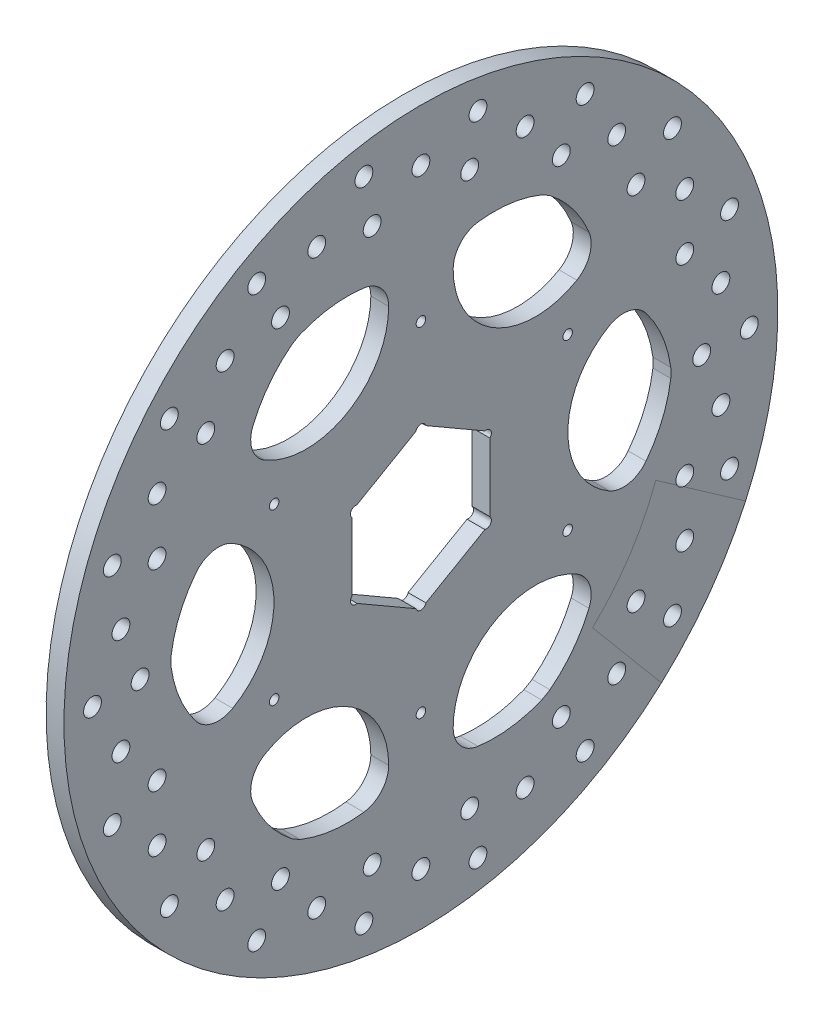
from build123d import *

# Parameters (mm, degrees)
SKETCH1_R           = 95.25
SKETCH1_R_2         = 66.675
MAIN_ROTOR_DEPTH    = 4.7625
SKETCH2_R           = 2.38125
CUT_SLOTS_DEPTH     = 135.788005424
BOSS_EXTRUDE2_START = -4.7625
BOSS_EXTRUDE2_DEPTH = 4.7625
SKETCH4_R           = 1.27
CUT_EXTRUDE2_DEPTH  = 135.788005424


with BuildPart() as part:
    # Sketch1 → Main Rotor (new body)
    with BuildSketch(Plane(origin=(0, 0, 0), x_dir=(0, 0, -1), z_dir=(1, 0, 0))):
        with Locations(Location((0, 0, 0), (0, 0, 180))):
            Circle(SKETCH1_R)
        with Locations(Location((0, 0, 0), (0, 0, 180))):
            Circle(SKETCH1_R_2, mode=Mode.SUBTRACT)
    extrude(amount=MAIN_ROTOR_DEPTH)

    # Sketch2 → Cut Slots (cut, through all)
    with BuildSketch(Plane(origin=(4.7625, 0, 0), x_dir=(0, 0, -1), z_dir=(1, 0, 0))):
        with Locations((-80.045174165, 14.114123881)):
            Circle(SKETCH2_R)
        with Locations((-82.345264359, 29.97122516)):
            Circle(SKETCH2_R)
        with Locations((-70.411168075, 25.627569339)):
            Circle(SKETCH2_R)
        with Locations((-70.39054482, 40.64)):
            Circle(SKETCH2_R)
        with Locations((-67.128474551, 56.327478237)):
            Circle(SKETCH2_R)
        with Locations((-57.399710123, 48.164075594)):
            Circle(SKETCH2_R)
        with Locations((-52.245776915, 62.264092337)):
            Circle(SKETCH2_R)
        with Locations((-87.63, 0)):
            Circle(SKETCH2_R)
        with Locations((-43.815, 75.889806134)):
            Circle(SKETCH2_R)
        with Locations((-37.465, 64.891283506)):
            Circle(SKETCH2_R)
        with Locations((-74.93, 0)):
            Circle(SKETCH2_R)
        with Locations((-27.79939725, 76.378216217)):
            Circle(SKETCH2_R)
        with Locations((-15.216789809, 86.298703396)):
            Circle(SKETCH2_R)
        with Locations((-13.011457953, 73.791644933)):
            Circle(SKETCH2_R)
        with Locations((0, 81.28)):
            Circle(SKETCH2_R)
        with Locations((15.216789809, 86.298703396)):
            Circle(SKETCH2_R)
        with Locations((13.011457953, 73.791644933)):
            Circle(SKETCH2_R)
        with Locations((27.79939725, 76.378216217)):
            Circle(SKETCH2_R)
        with Locations((43.815, 75.889806134)):
            Circle(SKETCH2_R)
        with Locations((37.465, 64.891283506)):
            Circle(SKETCH2_R)
        with Locations((52.245776915, 62.264092337)):
            Circle(SKETCH2_R)
        with Locations((67.128474551, 56.327478237)):
            Circle(SKETCH2_R)
        with Locations((57.399710123, 48.164075594)):
            Circle(SKETCH2_R)
        with Locations((70.39054482, 40.64)):
            Circle(SKETCH2_R)
        with Locations((82.345264359, 29.97122516)):
            Circle(SKETCH2_R)
        with Locations((70.411168075, 25.627569339)):
            Circle(SKETCH2_R)
        with Locations((80.045174165, 14.114123881)):
            Circle(SKETCH2_R)
        with Locations((87.63, 0)):
            Circle(SKETCH2_R)
        with Locations((74.93, 0)):
            Circle(SKETCH2_R)
        with Locations((80.045174165, -14.114123881)):
            Circle(SKETCH2_R)
        with Locations((82.345264359, -29.97122516)):
            Circle(SKETCH2_R)
        with Locations((70.411168075, -25.627569339)):
            Circle(SKETCH2_R)
        with Locations((70.39054482, -40.64)):
            Circle(SKETCH2_R)
        with Locations((67.128474551, -56.327478237)):
            Circle(SKETCH2_R)
        with Locations((57.399710123, -48.164075594)):
            Circle(SKETCH2_R)
        with Locations((52.245776915, -62.264092337)):
            Circle(SKETCH2_R)
        with Locations((43.815, -75.889806134)):
            Circle(SKETCH2_R)
        with Locations((37.465, -64.891283506)):
            Circle(SKETCH2_R)
        with Locations((27.79939725, -76.378216217)):
            Circle(SKETCH2_R)
        with Locations((15.216789809, -86.298703396)):
            Circle(SKETCH2_R)
        with Locations((13.011457953, -73.791644933)):
            Circle(SKETCH2_R)
        with Locations((0, -81.28)):
            Circle(SKETCH2_R)
        with Locations((-15.216789809, -86.298703396)):
            Circle(SKETCH2_R)
        with Locations((-13.011457953, -73.791644933)):
            Circle(SKETCH2_R)
        with Locations((-27.79939725, -76.378216217)):
            Circle(SKETCH2_R)
        with Locations((-43.815, -75.889806134)):
            Circle(SKETCH2_R)
        with Locations((-37.465, -64.891283506)):
            Circle(SKETCH2_R)
        with Locations((-52.245776915, -62.264092337)):
            Circle(SKETCH2_R)
        with Locations((-67.128474551, -56.327478237)):
            Circle(SKETCH2_R)
        with Locations((-57.399710123, -48.164075594)):
            Circle(SKETCH2_R)
        with Locations((-70.39054482, -40.64)):
            Circle(SKETCH2_R)
        with Locations((-82.345264359, -29.97122516)):
            Circle(SKETCH2_R)
        with Locations((-70.411168075, -25.627569339)):
            Circle(SKETCH2_R)
        with Locations((-80.045174165, -14.114123881)):
            Circle(SKETCH2_R)
    extrude(amount=-CUT_SLOTS_DEPTH, mode=Mode.SUBTRACT)

    # Sketch3 → Boss-Extrude2 (add)
    with BuildSketch(Plane(origin=(4.7625, 0, 0), x_dir=(0, 0, -1), z_dir=(1, 0, 0)).offset(BOSS_EXTRUDE2_START)):
        with BuildLine():
            ThreePointArc((15.226370254, -60.56863172), (10.49630902, -58.039692226), (8.604258147, -53.0208121))
            ThreePointArc((8.604258147, -53.0208121), (11.546477683, -42.011879168), (19.60245, -33.952439353))
            ThreePointArc((19.60245, -33.952439353), (30.610115778, -31.005482581), (41.615241134, -33.961912186))
            ThreePointArc((41.615241134, -33.961912186), (45.015693386, -38.109916371), (44.840788615, -43.470739307))
            ThreePointArc((44.840788615, -43.470739307), (40.527102575, -50.964468228), (34.431304095, -57.096768064))
            ThreePointArc((34.431304095, -57.096768064), (57.742243797, -33.3375), (66.662903665, -1.27))
            ThreePointArc((66.662903665, -1.27), (64.400075463, -9.615266258), (60.067158869, -17.097892412))
            ThreePointArc((60.067158869, -17.097892412), (55.512002406, -19.929775856), (50.219499281, -19.058899914))
            ThreePointArc((50.219499281, -19.058899914), (42.156593461, -11.006396586), (39.2049, 0))
            ThreePointArc((39.2049, 0), (42.156593461, 11.006396586), (50.219499281, 19.058899914))
            ThreePointArc((50.219499281, 19.058899914), (55.512002406, 19.929775856), (60.067158869, 17.097892412))
            ThreePointArc((60.067158869, 17.097892412), (64.400075463, 9.615266258), (66.662903665, 1.27))
            ThreePointArc((66.662903665, 1.27), (57.742243797, 33.3375), (34.431304095, 57.096768064))
            ThreePointArc((34.431304095, 57.096768064), (40.527102575, 50.964468228), (44.840788615, 43.470739307))
            ThreePointArc((44.840788615, 43.470739307), (45.015693386, 38.109916371), (41.615241134, 33.961912186))
            ThreePointArc((41.615241134, 33.961912186), (30.610115778, 31.005482581), (19.60245, 33.952439353))
            ThreePointArc((19.60245, 33.952439353), (11.546477683, 42.011879168), (8.604258147, 53.0208121))
            ThreePointArc((8.604258147, 53.0208121), (10.49630902, 58.039692226), (15.226370254, 60.56863172))
            ThreePointArc((15.226370254, 60.56863172), (23.872972888, 60.579734486), (32.23159957, 58.366768064))
            ThreePointArc((32.23159957, 58.366768064), (0, 66.675), (-32.23159957, 58.366768064))
            ThreePointArc((-32.23159957, 58.366768064), (-23.872972888, 60.579734486), (-15.226370254, 60.56863172))
            ThreePointArc((-15.226370254, 60.56863172), (-10.49630902, 58.039692226), (-8.604258147, 53.0208121))
            ThreePointArc((-8.604258147, 53.0208121), (-11.546477683, 42.011879168), (-19.60245, 33.952439353))
            ThreePointArc((-19.60245, 33.952439353), (-30.610115778, 31.005482581), (-41.615241134, 33.961912186))
            ThreePointArc((-41.615241134, 33.961912186), (-45.015693386, 38.109916371), (-44.840788615, 43.470739307))
            ThreePointArc((-44.840788615, 43.470739307), (-40.527102575, 50.964468228), (-34.431304095, 57.096768064))
            ThreePointArc((-34.431304095, 57.096768064), (-57.742243797, 33.3375), (-66.662903665, 1.27))
            ThreePointArc((-66.662903665, 1.27), (-64.400075463, 9.615266258), (-60.067158869, 17.097892412))
            ThreePointArc((-60.067158869, 17.097892412), (-55.512002406, 19.929775856), (-50.219499281, 19.058899914))
            ThreePointArc((-50.219499281, 19.058899914), (-42.156593461, 11.006396586), (-39.2049, 0))
            ThreePointArc((-39.2049, 0), (-42.156593461, -11.006396586), (-50.219499281, -19.058899914))
            ThreePointArc((-50.219499281, -19.058899914), (-55.512002406, -19.929775856), (-60.067158869, -17.097892412))
            ThreePointArc((-60.067158869, -17.097892412), (-64.400075463, -9.615266258), (-66.662903665, -1.27))
            ThreePointArc((-66.662903665, -1.27), (-57.742243797, -33.3375), (-34.431304095, -57.096768064))
            ThreePointArc((-34.431304095, -57.096768064), (-40.527102575, -50.964468228), (-44.840788615, -43.470739307))
            ThreePointArc((-44.840788615, -43.470739307), (-45.015693386, -38.109916371), (-41.615241134, -33.961912186))
            ThreePointArc((-41.615241134, -33.961912186), (-30.610115778, -31.005482581), (-19.60245, -33.952439353))
            ThreePointArc((-19.60245, -33.952439353), (-11.546477683, -42.011879168), (-8.604258147, -53.0208121))
            ThreePointArc((-8.604258147, -53.0208121), (-10.49630902, -58.039692226), (-15.226370254, -60.56863172))
            ThreePointArc((-15.226370254, -60.56863172), (-23.872972888, -60.579734486), (-32.23159957, -58.366768064))
            ThreePointArc((-32.23159957, -58.366768064), (0, -66.675), (32.23159957, -58.366768064))
            ThreePointArc((32.23159957, -58.366768064), (23.872972888, -60.579734486), (15.226370254, -60.56863172))
        make_face()
        with BuildLine():
            Line((-17.063421336, 11.397574816), (-1.338878664, 20.47614376))
            ThreePointArc((-1.338878664, 20.47614376), (0, 21.495208217), (1.338878664, 20.47614376))
            Line((1.338878664, 20.47614376), (17.063421336, 11.397574816))
            ThreePointArc((17.063421336, 11.397574816), (18.262343448, 11.151775183), (18.801495463, 10.053072859))
            ThreePointArc((18.801495463, 10.053072859), (18.697828196, 9.526523978), (18.4023, 9.078568944))
            Line((18.4023, 9.078568944), (18.4023, -9.078568944))
            ThreePointArc((18.4023, -9.078568944), (18.697828196, -9.526523978), (18.801495463, -10.053072859))
            ThreePointArc((18.801495463, -10.053072859), (18.262343448, -11.151775183), (17.063421336, -11.397574816))
            Line((17.063421336, -11.397574816), (1.338878664, -20.47614376))
            ThreePointArc((1.338878664, -20.47614376), (0, -21.495208217), (-1.338878664, -20.47614376))
            Line((-1.338878664, -20.47614376), (-17.063421336, -11.397574816))
            ThreePointArc((-17.063421336, -11.397574816), (-18.615396376, -10.747604109), (-18.4023, -9.078568944))
            Line((-18.4023, -9.078568944), (-18.4023, 9.078568944))
            ThreePointArc((-18.4023, 9.078568944), (-18.615396376, 10.747604109), (-17.063421336, 11.397574816))
        make_face(mode=Mode.SUBTRACT)
    extrude(amount=BOSS_EXTRUDE2_DEPTH)

    # Sketch4 → Cut-Extrude2 (cut, through all)
    with BuildSketch(Plane.ZY):
        with Locations((0, 45.212)):
            Circle(SKETCH4_R)
        with Locations((39.154740556, 22.606)):
            Circle(SKETCH4_R)
        with Locations((39.154740556, -22.606)):
            Circle(SKETCH4_R)
        with Locations((0, -45.212)):
            Circle(SKETCH4_R)
        with Locations((-39.154740556, -22.606)):
            Circle(SKETCH4_R)
        with Locations((-39.154740556, 22.606)):
            Circle(SKETCH4_R)
    extrude(amount=-CUT_EXTRUDE2_DEPTH, mode=Mode.SUBTRACT)


solid = part.part
